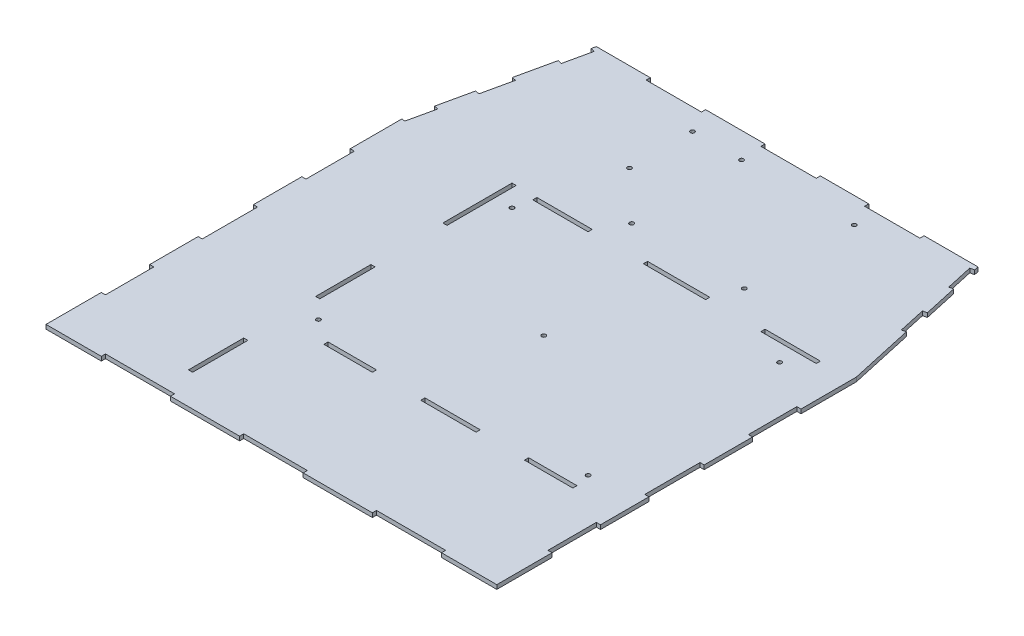
from build123d import *

# Parameters (mm, degrees)
BOSS_EXTRUDE1_DEPTH      = 3
SKETCH2_W                = 50
SKETCH2_H                = 3
SKETCH2_W_2              = 46
CUT_EXTRUDE1_DEPTH       = 4
SKETCH4_W                = 35
SKETCH4_H                = 3
SKETCH4_W_2              = 40
CUT_EXTRUDE2_DEPTH       = 3
CUT_EXTRUDE3_START       = -326
SKETCH4_2_W              = 35
SKETCH4_2_H              = 3
SKETCH4_2_W_2            = 40
CUT_EXTRUDE3_DEPTH       = 3
SKETCH5_W                = 40
SKETCH5_H                = 3
CUT_EXTRUDE4_DEPTH       = 3
CUT_EXTRUDE5_DEPTH       = 249.841314898
CUT_EXTRUDE5_DEPTH_BACK  = 249.841314898
SKETCH6_W                = 3
SKETCH6_H                = 40
SKETCH6_H_2              = 50
CUT_EXTRUDE6_DEPTH       = 249.841314898
CUT_EXTRUDE6_DEPTH_BACK  = 249.841314898
SKETCH7_W                = 40
SKETCH7_H                = 3
SKETCH7_W_2              = 45
CUT_EXTRUDE7_DEPTH       = 249.841314898
CUT_EXTRUDE7_DEPTH_BACK  = 249.841314898
CUT_EXTRUDE8_DEPTH       = 249.841314898
CUT_EXTRUDE8_DEPTH_BACK  = 249.841314898
CUT_EXTRUDE9_DEPTH       = 249.841314898
CUT_EXTRUDE9_DEPTH_BACK  = 249.841314898
SKETCH10_W               = 35
SKETCH10_H               = 3
SKETCH10_W_2             = 40
CUT_EXTRUDE10_DEPTH      = 249.841314898
CUT_EXTRUDE10_DEPTH_BACK = 249.841314898
SKETCH11_R               = 1.5
CUT_EXTRUDE11_DEPTH      = 249.841314898
CUT_EXTRUDE11_DEPTH_BACK = 249.841314898
SKETCH12_R               = 1.5


with BuildPart() as part:
    # Sketch1 → Boss-Extrude1 (new body)
    with BuildSketch(Plane(origin=(0, 0, 0), x_dir=(1, 0, 0), z_dir=(0, 1, 0))):
        Polygon((138, 185), (-138, 185), (-163, 72), (-163, -188), (163, -188), (163, 72), align=None)
    extrude(amount=BOSS_EXTRUDE1_DEPTH)

    # Sketch2 → Cut-Extrude1 (cut)
    with BuildSketch(Plane.XZ):
        with Locations((98, 186.5)):
            Rectangle(SKETCH2_W, SKETCH2_H)
        with Locations((0, 186.5)):
            Rectangle(SKETCH2_W_2, SKETCH2_H)
        with Locations((-98, 186.5)):
            Rectangle(SKETCH2_W, SKETCH2_H)
    extrude(amount=-CUT_EXTRUDE1_DEPTH, mode=Mode.SUBTRACT)

    # Sketch4 → Cut-Extrude2 (cut)
    with BuildSketch(Plane.ZY.offset(163)):
        with Locations((130.5, 1.5)):
            Rectangle(SKETCH4_W, SKETCH4_H)
        with Locations((-14.5, 1.5)):
            Rectangle(SKETCH4_W, SKETCH4_H)
        with Locations((58, 1.5)):
            Rectangle(SKETCH4_W_2, SKETCH4_H)
    extrude(amount=-CUT_EXTRUDE2_DEPTH, mode=Mode.SUBTRACT)

    # Sketch4<2> → Cut-Extrude3 (cut)
    with BuildSketch(Plane.ZY.offset(163).offset(CUT_EXTRUDE3_START)):
        with Locations((130.5, 1.5)):
            Rectangle(SKETCH4_2_W, SKETCH4_2_H)
        with Locations((-14.5, 1.5)):
            Rectangle(SKETCH4_2_W, SKETCH4_2_H)
        with Locations((58, 1.5)):
            Rectangle(SKETCH4_2_W_2, SKETCH4_2_H)
    extrude(amount=CUT_EXTRUDE3_DEPTH, mode=Mode.SUBTRACT)

    # Sketch5 → Cut-Extrude4 (cut)
    with BuildSketch(Plane(origin=(0, 0, -185), x_dir=(-1, 0, 0), z_dir=(0, 0, -1))):
        with Locations((79, 1.5)):
            Rectangle(SKETCH5_W, SKETCH5_H)
        with Locations((-4, 1.5)):
            Rectangle(SKETCH5_W, SKETCH5_H)
        with Locations((-79, 1.5)):
            Rectangle(SKETCH5_W, SKETCH5_H)
    extrude(amount=-CUT_EXTRUDE4_DEPTH, mode=Mode.SUBTRACT)

    # Sketch6 → Cut-Extrude5 (cut, two sides: drawn at the far end of the back side and taken through both)
    with BuildSketch(Plane.XZ.offset(-CUT_EXTRUDE5_DEPTH_BACK)):
        with Locations((-81.5, 145)):
            Rectangle(SKETCH6_W, SKETCH6_H)
        with Locations((-81.5, 53)):
            Rectangle(SKETCH6_W, SKETCH6_H)
        with Locations((-81.5, -44)):
            Rectangle(SKETCH6_W, SKETCH6_H_2)
    extrude(amount=CUT_EXTRUDE5_DEPTH + CUT_EXTRUDE5_DEPTH_BACK, mode=Mode.SUBTRACT)

    # Sketch7 → Cut-Extrude6 (cut, two sides: drawn at the far end of the back side and taken through both)
    with BuildSketch(Plane.XZ.offset(-CUT_EXTRUDE6_DEPTH_BACK)):
        with Locations((120, -67.5)):
            Rectangle(SKETCH7_W, SKETCH7_H)
        with Locations((37.5, -67.5)):
            Rectangle(SKETCH7_W_2, SKETCH7_H)
        with Locations((-45, -67.5)):
            Rectangle(SKETCH7_W, SKETCH7_H)
    extrude(amount=CUT_EXTRUDE6_DEPTH + CUT_EXTRUDE6_DEPTH_BACK, mode=Mode.SUBTRACT)

    # Sketch8 → Cut-Extrude7 (cut, two sides: drawn at the far end of the back side and taken through both)
    with BuildSketch(Plane(origin=(0, 0, 0), x_dir=(-1, 0, 0), z_dir=(0, -1, 0)).offset(-CUT_EXTRUDE7_DEPTH_BACK)):
        Polygon((135.749394441, 181.284843117), (138.678564262, 181.932889537), (142.998873731, 162.405090734), (140.069703911, 161.757044314), align=None)
        Polygon((146.083574693, 134.57434838), (149.012744513, 135.222394801), (153.799647406, 113.585593727), (150.870477585, 112.937547307), align=None)
        Polygon((156.270864422, 88.527798803), (160.591173892, 69), (163.520343712, 69.64804642), (159.200034243, 89.175845223), align=None)
    extrude(amount=CUT_EXTRUDE7_DEPTH + CUT_EXTRUDE7_DEPTH_BACK, mode=Mode.SUBTRACT)

    # Sketch9 → Cut-Extrude8 (cut, two sides: drawn at the far end of the back side and taken through both)
    with BuildSketch(Plane.XZ.offset(-CUT_EXTRUDE8_DEPTH_BACK)):
        Polygon((138.678564262, -181.932889537), (135.749394441, -181.284843117), (140.069703911, -161.757044314), (142.998873731, -162.405090734), align=None)
        Polygon((145.470090748, -137.34729581), (148.399260568, -137.995342231), (152.719570038, -118.467543428), (149.790400218, -117.819497007), align=None)
    extrude(amount=CUT_EXTRUDE8_DEPTH + CUT_EXTRUDE8_DEPTH_BACK, mode=Mode.SUBTRACT)

    # Sketch10 → Cut-Extrude9 (cut, two sides: drawn at the far end of the back side and taken through both)
    with BuildSketch(Plane.XZ.offset(-CUT_EXTRUDE9_DEPTH_BACK)):
        with Locations((112.5, 98.5)):
            Rectangle(SKETCH10_W, SKETCH10_H)
        with Locations((40, 98.5)):
            Rectangle(SKETCH10_W_2, SKETCH10_H)
        with Locations((-32.5, 98.5)):
            Rectangle(SKETCH10_W, SKETCH10_H)
    extrude(amount=CUT_EXTRUDE9_DEPTH + CUT_EXTRUDE9_DEPTH_BACK, mode=Mode.SUBTRACT)

    # Sketch11 → Cut-Extrude10 (cut, two sides: drawn at the far end of the back side and taken through both)
    with BuildSketch(Plane.XZ.offset(-CUT_EXTRUDE10_DEPTH_BACK)):
        with Locations(Location((67, -166.5, 0), (0, 0, 270))):
            Circle(SKETCH11_R)
        with Locations(Location((-14.5, -166.5, 0), (0, 0, 270))):
            Circle(SKETCH11_R)
        with Locations(Location((-50, -166.5, 0), (0, 0, 270))):
            Circle(SKETCH11_R)
        with Locations(Location((67, -87, 0), (0, 0, 270))):
            Circle(SKETCH11_R)
        with Locations(Location((-14.5, -87, 0), (0, 0, 270))):
            Circle(SKETCH11_R)
        with Locations(Location((-50, -120.9, 0), (0, 0, 270))):
            Circle(SKETCH11_R)
    extrude(amount=CUT_EXTRUDE10_DEPTH + CUT_EXTRUDE10_DEPTH_BACK, mode=Mode.SUBTRACT)

    # Sketch12 → Cut-Extrude11 (cut, two sides: drawn at the far end of the back side and taken through both)
    with BuildSketch(Plane.XZ.offset(-CUT_EXTRUDE11_DEPTH_BACK)):
        with Locations(Location((126, -53.5, 0), (0, 0, 270))):
            Circle(SKETCH12_R)
        with Locations(Location((127.499999834, 86.491964057, 0), (0, 0, 270))):
            Circle(SKETCH12_R)
        with Locations(Location((-67.5, -53.5, 0), (0, 0, 270))):
            Circle(SKETCH12_R)
        with Locations(Location((-67.5, 86.5, 0), (0, 0, 270))):
            Circle(SKETCH12_R)
        with Locations(Location((24, 15, 0), (0, 0, 270))):
            Circle(SKETCH12_R)
    extrude(amount=CUT_EXTRUDE11_DEPTH + CUT_EXTRUDE11_DEPTH_BACK, mode=Mode.SUBTRACT)


solid = part.part
